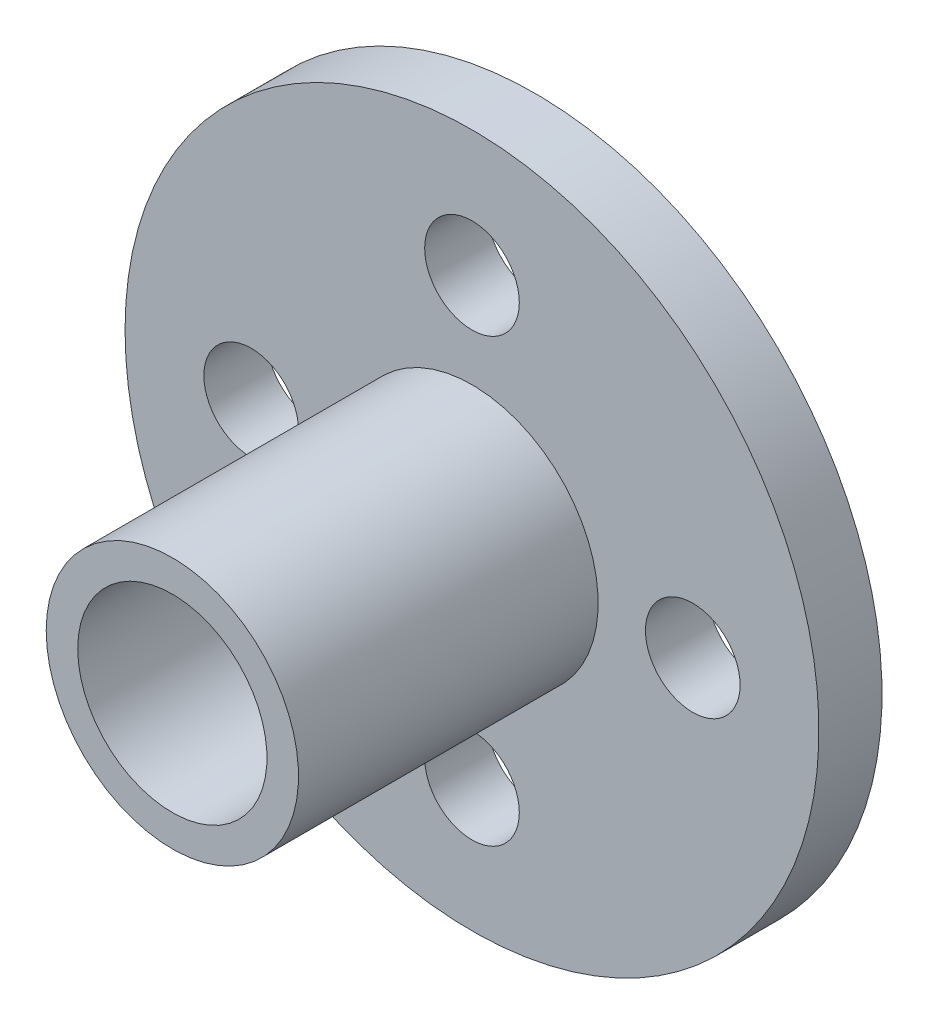
from build123d import *

# Parameters (mm, degrees)
SKETCH_2_R          = 1.5
CUT_EXTRUDE_1_DEPTH = 10


with BuildPart() as part:
    # 草图1 → 旋转1 (revolve)
    with BuildSketch(Plane(origin=(0, 0, 0), x_dir=(1, 0, 0), z_dir=(0, 1, 0))):
        Polygon((0, 0), (-8, 0), (-8, -2), (-1, -2), (-1, -11.5), (0, -11.5), align=None)
    revolve(axis=Axis((3, 0, -3.355756156), (0, 0, 1)))

    # 草图2 → 切除-拉伸1 (cut)
    with BuildSketch(Plane(origin=(0, 0, 0), x_dir=(-1, 0, 0), z_dir=(0, 0, -1))):
        with Locations((-3, 7)):
            Circle(SKETCH_2_R)
        with Locations((4, 0)):
            Circle(SKETCH_2_R)
        with Locations((-3, -7)):
            Circle(SKETCH_2_R)
        with Locations((-10, 0)):
            Circle(SKETCH_2_R)
    extrude(amount=-CUT_EXTRUDE_1_DEPTH, mode=Mode.SUBTRACT)


solid = part.part
